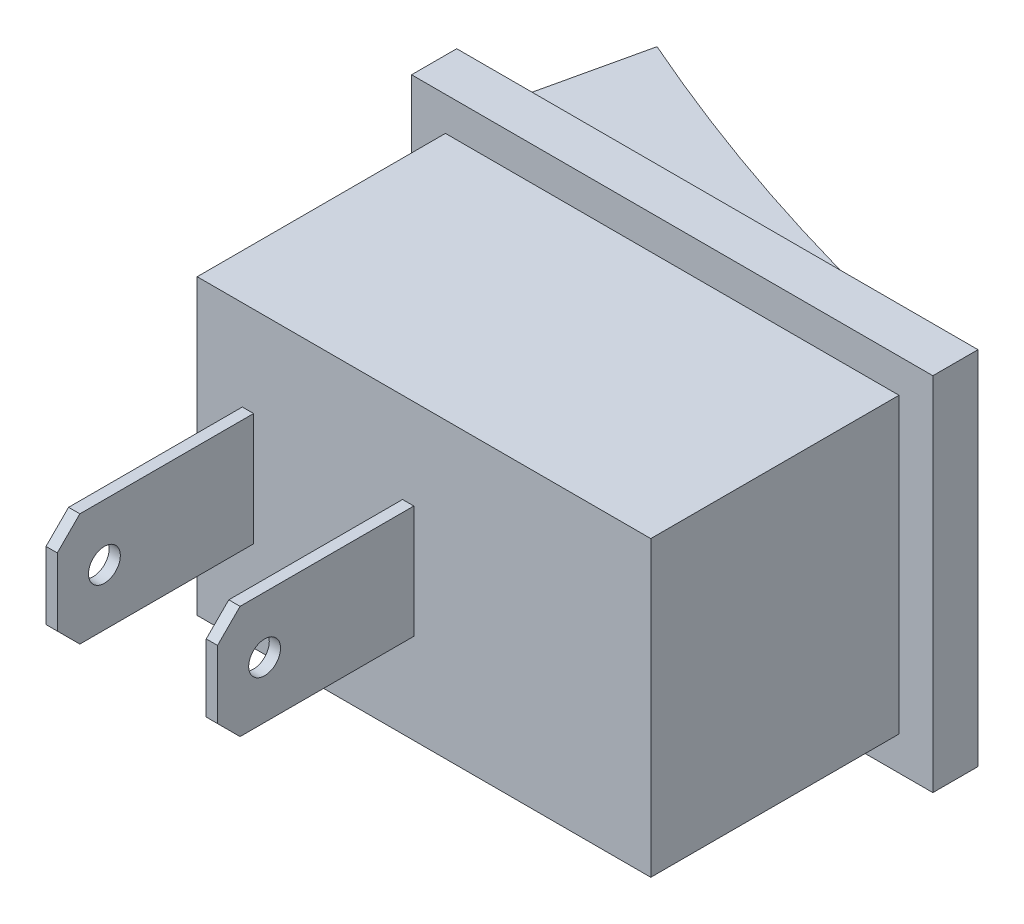
from build123d import *

# Parameters (mm, degrees)
SKIZZE1_W                       = 20.1
SKIZZE1_H                       = 13
AUFSATZ_LINEAR_AUSTRAGEN1_DEPTH = 11
SKIZZE2_W                       = 0.5
SKIZZE2_H                       = 5
AUFSATZ_LINEAR_AUSTRAGEN2_DEPTH = 8.7
SKIZZE4_R                       = 0.706106742
SCHNITT_LINEAR_AUSTRAGEN1_DEPTH = 8.7
FASE1_SIZE                      = 1
SKIZZE5_W                       = 23.1
SKIZZE5_H                       = 16
AUFSATZ_LINEAR_AUSTRAGEN3_DEPTH = 2
AUFSATZ_LINEAR_AUSTRAGEN4_DEPTH = 13


with BuildPart() as part:
    # Skizze1 → Aufsatz-Linear austragen1 (new body)
    with BuildSketch(Plane.XY):
        with Locations((10.05, -6.5)):
            Rectangle(SKIZZE1_W, SKIZZE1_H)
    extrude(amount=AUFSATZ_LINEAR_AUSTRAGEN1_DEPTH)

    # Skizze2 → Aufsatz-Linear austragen2 (add)
    with BuildSketch(Plane.XY.offset(11)):
        with Locations((2.25, -6.5)):
            Rectangle(SKIZZE2_W, SKIZZE2_H)
        with Locations((9.35, -6.5)):
            Rectangle(SKIZZE2_W, SKIZZE2_H)
    extrude(amount=AUFSATZ_LINEAR_AUSTRAGEN2_DEPTH)

    # Skizze4 → Schnitt-Linear austragen1 (cut)
    with BuildSketch(Plane.ZY.offset(-2)):
        with Locations((17.612214696, -6.5)):
            Circle(SKIZZE4_R)
    extrude(amount=-SCHNITT_LINEAR_AUSTRAGEN1_DEPTH, mode=Mode.SUBTRACT)

    # Fase1
    fase1_edges = [part.edges().sort_by_distance(p)[0] for p in [
        (2.25, -4, 19.7),
        (2.25, -9, 19.7),
        (9.35, -9, 19.7),
        (9.35, -4, 19.7),
    ]]
    chamfer(fase1_edges, length=FASE1_SIZE)

    # Skizze5 → Aufsatz-Linear austragen3 (add)
    with BuildSketch(Plane(origin=(0, 0, 0), x_dir=(-1, 0, 0), z_dir=(0, 0, -1))):
        with Locations((-10.05, -6.5)):
            Rectangle(SKIZZE5_W, SKIZZE5_H)
    extrude(amount=AUFSATZ_LINEAR_AUSTRAGEN3_DEPTH)

    # Skizze6 → Aufsatz-Linear austragen4 (add)
    with BuildSketch(Plane(origin=(0, 0, 0), x_dir=(1, 0, 0), z_dir=(0, 1, 0))):
        with BuildLine():
            Line((0, 2), (1.361035654, 8.016649053))
            ThreePointArc((1.361035654, 8.016649053), (10.576058723, 4.527258802), (20.1, 2))
            Line((20.1, 2), (0, 2))
        make_face()
    extrude(amount=-AUFSATZ_LINEAR_AUSTRAGEN4_DEPTH)


solid = part.part
